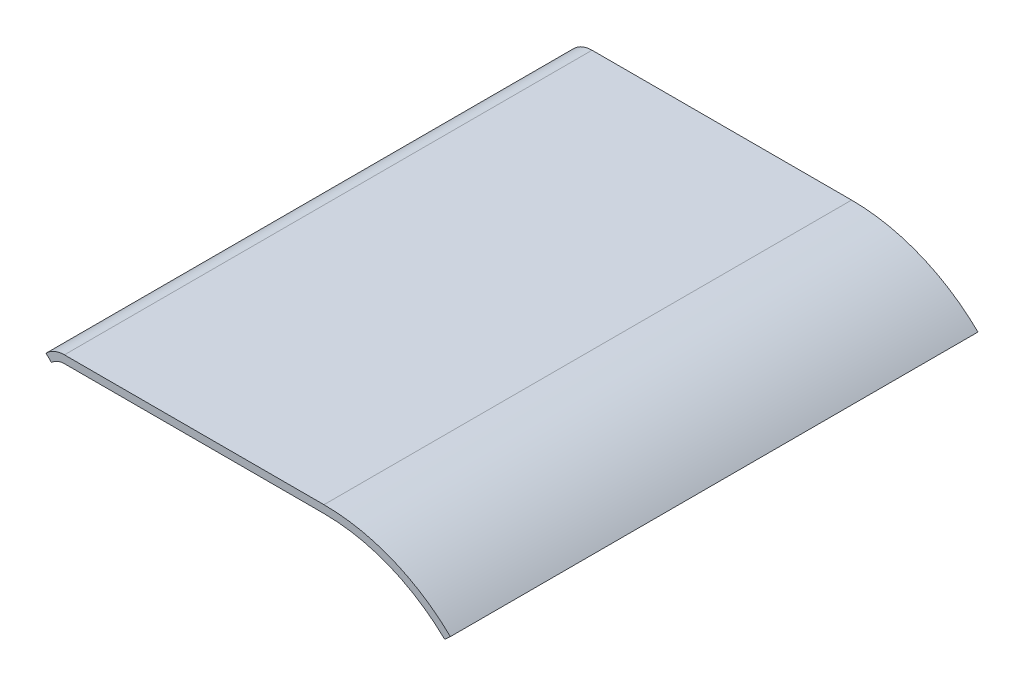
from build123d import *

# Parameters (mm, degrees)
BOSS_EXTRUDE1_DEPTH = 206


with BuildPart() as part:
    # Sketch1 → Boss-Extrude1 (new body)
    with BuildSketch(Plane.XY):
        with BuildLine():
            Line((0, 0), (101.34, 0))
            ThreePointArc((101.34, 0), (127.952052396, -5.172858972), (150.688530637, -19.938100584))
            Line((150.688530637, -19.938100584), (148.453411139, -21.95061122))
            ThreePointArc((148.453411139, -21.95061122), (126.730939205, -7.915188663), (101.34, -3))
            Line((101.34, -3), (0, -3))
            ThreePointArc((0, -3), (-2.735117899, -3.556466026), (-5.035378602, -5.137391407))
            Line((-5.035378602, -5.137391407), (-7.193398003, -3.053416295))
            ThreePointArc((-7.193398003, -3.053416295), (-3.907311285, -0.794951465), (0, 0))
        make_face()
    extrude(amount=BOSS_EXTRUDE1_DEPTH)


solid = part.part
